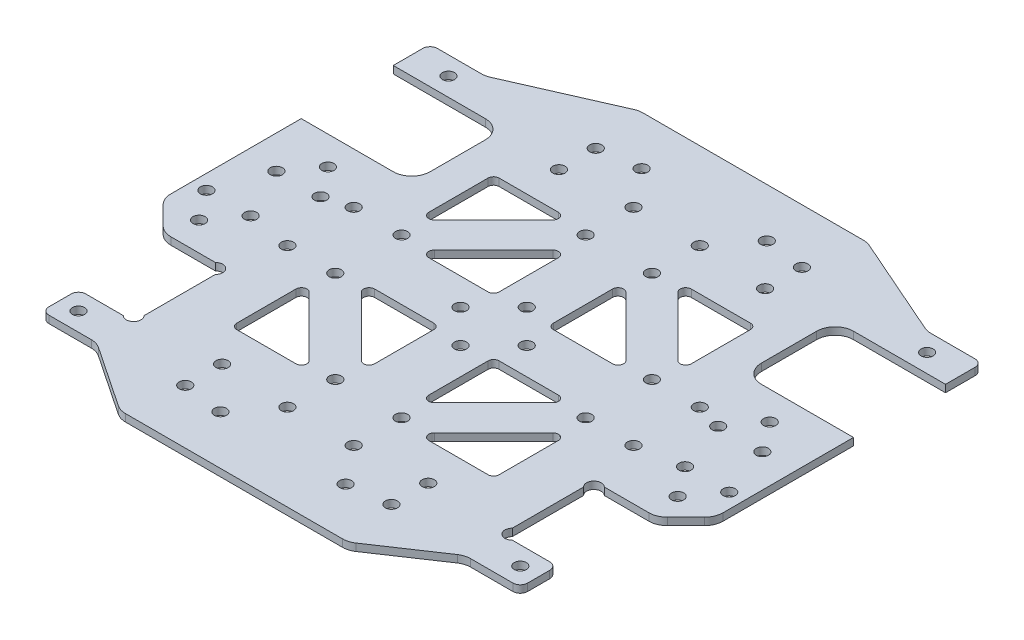
from build123d import *

# Parameters (mm, degrees)
SKETCH_1_W                         = 150
SKETCH_1_H                         = 141
EXTRUDE_1_DEPTH                    = 2
CUT_EXTRUDE_1_REACH                = 104.953
SKETCH_2_R                         = 1.65
CUT_EXTRUDE_5_REACH                = 104.953
SKETCH_9_W                         = 25
SKETCH_9_H                         = 47.75
CUT_EXTRUDE_6_REACH                = 104.953
CHAMFER_1_SIZE                     = 8
CUT_EXTRUDE_7_REACH                = 104.953
SKETCH_11_W                        = 30
SKETCH_11_H                        = 25
CUT_EXTRUDE_8_REACH                = 104.953
SKETCH_12_R                        = 1.65
FILLET_1_R                         = 5
CUT_EXTRUDE_9_REACH                = 104.953
SKETCH_14_W                        = 15
SKETCH_14_H                        = 10
EXTRUDE_2_DEPTH                    = 2
CUT_EXTRUDE_10_REACH               = 104.953
SKETCH_15_R                        = 1.65
CUT_EXTRUDE_START                  = -2
SKETCH_18_R                        = 2
CUT_EXTRUDE_13_DEPTH               = 2
CUT_EXTRUDE_14_REACH               = 104.953
SKETCH_19_R                        = 1.65
CUT_EXTRUDE_15_REACH               = 104.953
SKETCH_20_R                        = 1.65
FILLET_2_R                         = 2
CUT_EXTRUDE_12_REACH               = 104.953
SKETCH_17_R                        = 1.65
FILLET_3_R                         = 5
PATTERN_CIRCULAR_1_COUNT           = 2
PATTERN_CIRCULAR_1_ANGLE           = 90
PATTERN_CIRCULAR_1_COPY_1_REACH    = 104.953
PATTERN_CIRCULAR_1_COPY_1_SKETCH_R = 1.65
CUT_EXTRUDE_18_REACH               = 104.953
SKETCH_25_R                        = 1.65
CUT_EXTRUDE_19_REACH               = 104.953
FILLET_4_R                         = 1.5
FILLET_4_OF_MIRROR_6_R             = 1.5


with BuildPart() as part:
    # 草图1 → 凸台-拉伸1 (new body)
    with BuildSketch(Plane(origin=(0, 0, 0), x_dir=(1, 0, 0), z_dir=(0, 1, 0))):
        Rectangle(SKETCH_1_W, SKETCH_1_H)
    extrude(amount=EXTRUDE_1_DEPTH)

    # 草图2 → 切除-拉伸1 (cut, up to next)
    with BuildSketch(Plane(origin=(0, 2, 0), x_dir=(1, 0, 0), z_dir=(0, 1, 0)), mode=Mode.PRIVATE) as cut_extrude_1_sk1:
        with Locations(Location((-60, 15, 0), (0, 0, 270))):
            Circle(SKETCH_2_R)
    cut_extrude_1_tool1 = extrude(cut_extrude_1_sk1.sketch, amount=-CUT_EXTRUDE_1_REACH, mode=Mode.PRIVATE) & part.part
    # 草图2 → 切除-拉伸1 (cut, up to next)
    with BuildSketch(Plane(origin=(0, 2, 0), x_dir=(1, 0, 0), z_dir=(0, 1, 0)), mode=Mode.PRIVATE) as cut_extrude_1_sk2:
        with Locations(Location((-66, 7, 0), (0, 0, 270))):
            Circle(SKETCH_2_R)
    cut_extrude_1_tool2 = extrude(cut_extrude_1_sk2.sketch, amount=-CUT_EXTRUDE_1_REACH, mode=Mode.PRIVATE) & part.part
    # 草图2 → 切除-拉伸1 (cut, up to next)
    with BuildSketch(Plane(origin=(0, 2, 0), x_dir=(1, 0, 0), z_dir=(0, 1, 0)), mode=Mode.PRIVATE) as cut_extrude_1_sk3:
        with Locations(Location((-54, 7, 0), (0, 0, 270))):
            Circle(SKETCH_2_R)
    cut_extrude_1_tool3 = extrude(cut_extrude_1_sk3.sketch, amount=-CUT_EXTRUDE_1_REACH, mode=Mode.PRIVATE) & part.part
    # 草图2 → 切除-拉伸1 (cut, up to next)
    with BuildSketch(Plane(origin=(0, 2, 0), x_dir=(1, 0, 0), z_dir=(0, 1, 0)), mode=Mode.PRIVATE) as cut_extrude_1_sk4:
        with Locations(Location((-71, -7, 0), (0, 0, 270))):
            Circle(SKETCH_2_R)
    cut_extrude_1_tool4 = extrude(cut_extrude_1_sk4.sketch, amount=-CUT_EXTRUDE_1_REACH, mode=Mode.PRIVATE) & part.part
    # 草图2 → 切除-拉伸1 (cut, up to next)
    with BuildSketch(Plane(origin=(0, 2, 0), x_dir=(1, 0, 0), z_dir=(0, 1, 0)), mode=Mode.PRIVATE) as cut_extrude_1_sk5:
        with Locations(Location((-59, -7, 0), (0, 0, 270))):
            Circle(SKETCH_2_R)
    cut_extrude_1_tool5 = extrude(cut_extrude_1_sk5.sketch, amount=-CUT_EXTRUDE_1_REACH, mode=Mode.PRIVATE) & part.part
    # 草图2 → 切除-拉伸1 (cut, up to next)
    with BuildSketch(Plane(origin=(0, 2, 0), x_dir=(1, 0, 0), z_dir=(0, 1, 0)), mode=Mode.PRIVATE) as cut_extrude_1_sk6:
        with Locations(Location((-65, -15, 0), (0, 0, 270))):
            Circle(SKETCH_2_R)
    cut_extrude_1_tool6 = extrude(cut_extrude_1_sk6.sketch, amount=-CUT_EXTRUDE_1_REACH, mode=Mode.PRIVATE) & part.part
    cut_extrude_1_1 = cut_extrude_1_tool1.solids().sort_by_distance((-60, 2, -15))[0]
    add(cut_extrude_1_1, mode=Mode.SUBTRACT)
    cut_extrude_1_2 = cut_extrude_1_tool2.solids().sort_by_distance((-66, 2, -7))[0]
    add(cut_extrude_1_2, mode=Mode.SUBTRACT)
    cut_extrude_1_3 = cut_extrude_1_tool3.solids().sort_by_distance((-54, 2, -7))[0]
    add(cut_extrude_1_3, mode=Mode.SUBTRACT)
    cut_extrude_1_4 = cut_extrude_1_tool4.solids().sort_by_distance((-71, 2, 7))[0]
    add(cut_extrude_1_4, mode=Mode.SUBTRACT)
    cut_extrude_1_5 = cut_extrude_1_tool5.solids().sort_by_distance((-59, 2, 7))[0]
    add(cut_extrude_1_5, mode=Mode.SUBTRACT)
    cut_extrude_1_6 = cut_extrude_1_tool6.solids().sort_by_distance((-65, 2, 15))[0]
    add(cut_extrude_1_6, mode=Mode.SUBTRACT)
    cut_extrude_1 = cut_extrude_1_1 + cut_extrude_1_2 + cut_extrude_1_3 + cut_extrude_1_4 + cut_extrude_1_5 + cut_extrude_1_6  # 切除-拉伸1 as one shape, for the pattern or mirror that repeats it

    # 草图9 → 切除-拉伸5 (cut, up to next)
    with BuildSketch(Plane(origin=(0, 2, 0), x_dir=(1, 0, 0), z_dir=(0, 1, 0)), mode=Mode.PRIVATE) as cut_extrude_5_sk1:
        with Locations((-62.5, -46.625)):
            Rectangle(SKETCH_9_W, SKETCH_9_H)
    cut_extrude_5_tool1 = extrude(cut_extrude_5_sk1.sketch, amount=-CUT_EXTRUDE_5_REACH, mode=Mode.PRIVATE) & part.part
    # 草图9 → 切除-拉伸5 (cut, up to next)
    with BuildSketch(Plane(origin=(0, 2, 0), x_dir=(1, 0, 0), z_dir=(0, 1, 0)), mode=Mode.PRIVATE) as cut_extrude_5_sk2:
        with Locations((62.5, -46.625)):
            Rectangle(SKETCH_9_W, SKETCH_9_H)
    cut_extrude_5_tool2 = extrude(cut_extrude_5_sk2.sketch, amount=-CUT_EXTRUDE_5_REACH, mode=Mode.PRIVATE) & part.part
    add(cut_extrude_5_tool1.solids().sort_by_distance((-62.5, 2, 46.625))[0], mode=Mode.SUBTRACT)
    add(cut_extrude_5_tool2.solids().sort_by_distance((62.5, 2, 46.625))[0], mode=Mode.SUBTRACT)

    # 草图10 → 切除-拉伸6 (cut, up to next)
    with BuildSketch(Plane(origin=(0, 2, 0), x_dir=(1, 0, 0), z_dir=(0, 1, 0)), mode=Mode.PRIVATE) as cut_extrude_6_sk1:
        Polygon((-75, 70.5), (-31, 70.5), (-60, 57.75), (-75, 57.75), align=None)
    cut_extrude_6_tool1 = extrude(cut_extrude_6_sk1.sketch, amount=-CUT_EXTRUDE_6_REACH, mode=Mode.PRIVATE) & part.part
    cut_extrude_6 = cut_extrude_6_tool1.solids().sort_by_distance((-59.062147, 2, -65.169492))[0]
    add(cut_extrude_6, mode=Mode.SUBTRACT)

    # 镜向1: 切除-拉伸1, 切除-拉伸6 across plane
    add(cut_extrude_1.mirror(Plane(origin=(0, 0, 0), x_dir=(0, 0, 1), z_dir=(1, 0, 0))), mode=Mode.SUBTRACT)
    add(cut_extrude_6.mirror(Plane(origin=(0, 0, 0), x_dir=(0, 0, 1), z_dir=(1, 0, 0))), mode=Mode.SUBTRACT)

    # 倒角1
    chamfer_1_edges = [part.edges().sort_by_distance(p)[0] for p in [
        (-75, 1, 22.75),
        (75, 1, 22.75),
    ]]
    chamfer(chamfer_1_edges, length=CHAMFER_1_SIZE)

    # 草图11 → 切除-拉伸7 (cut, up to next)
    with BuildSketch(Plane(origin=(0, 2, 0), x_dir=(1, 0, 0), z_dir=(0, 1, 0)), mode=Mode.PRIVATE) as cut_extrude_7_sk1:
        with Locations((-60, 35.25)):
            Rectangle(SKETCH_11_W, SKETCH_11_H)
    cut_extrude_7_tool1 = extrude(cut_extrude_7_sk1.sketch, amount=-CUT_EXTRUDE_7_REACH, mode=Mode.PRIVATE) & part.part
    # 草图11 → 切除-拉伸7 (cut, up to next)
    with BuildSketch(Plane(origin=(0, 2, 0), x_dir=(1, 0, 0), z_dir=(0, 1, 0)), mode=Mode.PRIVATE) as cut_extrude_7_sk2:
        with Locations((60, 35.25)):
            Rectangle(SKETCH_11_W, SKETCH_11_H)
    cut_extrude_7_tool2 = extrude(cut_extrude_7_sk2.sketch, amount=-CUT_EXTRUDE_7_REACH, mode=Mode.PRIVATE) & part.part
    add(cut_extrude_7_tool1.solids().sort_by_distance((-60, 2, -35.25))[0], mode=Mode.SUBTRACT)
    add(cut_extrude_7_tool2.solids().sort_by_distance((60, 2, -35.25))[0], mode=Mode.SUBTRACT)

    # 草图12 → 切除-拉伸8 (cut, up to next)
    with BuildSketch(Plane(origin=(0, 2, 0), x_dir=(1, 0, 0), z_dir=(0, 1, 0)), mode=Mode.PRIVATE) as cut_extrude_8_sk1:
        with Locations(Location((-65, 52.75, 0), (0, 0, 270))):
            Circle(SKETCH_12_R)
    cut_extrude_8_tool1 = extrude(cut_extrude_8_sk1.sketch, amount=-CUT_EXTRUDE_8_REACH, mode=Mode.PRIVATE) & part.part
    # 草图12 → 切除-拉伸8 (cut, up to next)
    with BuildSketch(Plane(origin=(0, 2, 0), x_dir=(1, 0, 0), z_dir=(0, 1, 0)), mode=Mode.PRIVATE) as cut_extrude_8_sk2:
        with Locations(Location((65, 52.75, 0), (0, 0, 90))):
            Circle(SKETCH_12_R)
    cut_extrude_8_tool2 = extrude(cut_extrude_8_sk2.sketch, amount=-CUT_EXTRUDE_8_REACH, mode=Mode.PRIVATE) & part.part
    add(cut_extrude_8_tool1.solids().sort_by_distance((-65, 2, -52.75))[0], mode=Mode.SUBTRACT)
    add(cut_extrude_8_tool2.solids().sort_by_distance((65, 2, -52.75))[0], mode=Mode.SUBTRACT)

    # 圆角1
    fillet_1_edges = [part.edges().sort_by_distance(p)[0] for p in [
        (67, 1, 22.75),
        (75, 1, 14.75),
        (-75, 1, 14.75),
        (-67, 1, 22.75),
        (-45, 1, -47.75),
        (-45, 1, -22.75),
        (45, 1, -22.75),
        (45, 1, -47.75),
    ]]
    fillet(fillet_1_edges, radius=FILLET_1_R)

    # 草图13 → 切除-拉伸9 (cut, up to next)
    with BuildSketch(Plane(origin=(0, 2, 0), x_dir=(1, 0, 0), z_dir=(0, 1, 0)), mode=Mode.PRIVATE) as cut_extrude_9_sk1:
        Polygon((-50, -70.5), (-50, -57.75), (-31, -70.5), align=None)
    cut_extrude_9_tool1 = extrude(cut_extrude_9_sk1.sketch, amount=-CUT_EXTRUDE_9_REACH, mode=Mode.PRIVATE) & part.part
    cut_extrude_9 = cut_extrude_9_tool1.solids().sort_by_distance((-43.666667, 2, 66.25))[0]
    add(cut_extrude_9, mode=Mode.SUBTRACT)

    # 草图14 → 凸台-拉伸2 (add)
    with BuildSketch(Plane(origin=(0, 0, 0), x_dir=(1, 0, 0), z_dir=(0, 1, 0))):
        with Locations((-57.5, -52.75)):
            Rectangle(SKETCH_14_W, SKETCH_14_H)
    extrude_2 = extrude(amount=EXTRUDE_2_DEPTH)

    # 草图15 → 切除-拉伸10 (cut, up to next)
    with BuildSketch(Plane(origin=(0, 2, 0), x_dir=(1, 0, 0), z_dir=(0, 1, 0)), mode=Mode.PRIVATE) as cut_extrude_10_sk1:
        with Locations(Location((-60, -52.75, 0), (0, 0, 270))):
            Circle(SKETCH_15_R)
    cut_extrude_10_tool1 = extrude(cut_extrude_10_sk1.sketch, amount=-CUT_EXTRUDE_10_REACH, mode=Mode.PRIVATE) & part.part
    cut_extrude_10 = cut_extrude_10_tool1.solids().sort_by_distance((-60, 2, 52.75))[0]
    add(cut_extrude_10, mode=Mode.SUBTRACT)

    # 草图18 → 切除-拉伸13 (cut)
    with BuildSketch(Plane(origin=(0, 2, 0), x_dir=(1, 0, 0), z_dir=(0, 1, 0)).offset(CUT_EXTRUDE_START)):
        with Locations((-51.414213562, -24.164213562)):
            Circle(SKETCH_18_R)
        with Locations((-51.414213562, -46.335786438)):
            Circle(SKETCH_18_R)
    cut_extrude_13 = extrude(amount=CUT_EXTRUDE_13_DEPTH, mode=Mode.SUBTRACT)

    # 草图19 → 切除-拉伸14 (cut, up to next)
    with BuildSketch(Plane(origin=(0, 2, 0), x_dir=(1, 0, 0), z_dir=(0, 1, 0)), mode=Mode.PRIVATE) as cut_extrude_14_sk1:
        with Locations(Location((-47, 9, 0), (0, 0, 270))):
            Circle(SKETCH_19_R)
    cut_extrude_14_tool1 = extrude(cut_extrude_14_sk1.sketch, amount=-CUT_EXTRUDE_14_REACH, mode=Mode.PRIVATE) & part.part
    # 草图19 → 切除-拉伸14 (cut, up to next)
    with BuildSketch(Plane(origin=(0, 2, 0), x_dir=(1, 0, 0), z_dir=(0, 1, 0)), mode=Mode.PRIVATE) as cut_extrude_14_sk2:
        with Locations(Location((-47, -9, 0), (0, 0, 270))):
            Circle(SKETCH_19_R)
    cut_extrude_14_tool2 = extrude(cut_extrude_14_sk2.sketch, amount=-CUT_EXTRUDE_14_REACH, mode=Mode.PRIVATE) & part.part
    # 草图19 → 切除-拉伸14 (cut, up to next)
    with BuildSketch(Plane(origin=(0, 2, 0), x_dir=(1, 0, 0), z_dir=(0, 1, 0)), mode=Mode.PRIVATE) as cut_extrude_14_sk3:
        with Locations(Location((-34, -9, 0), (0, 0, 270))):
            Circle(SKETCH_19_R)
    cut_extrude_14_tool3 = extrude(cut_extrude_14_sk3.sketch, amount=-CUT_EXTRUDE_14_REACH, mode=Mode.PRIVATE) & part.part
    # 草图19 → 切除-拉伸14 (cut, up to next)
    with BuildSketch(Plane(origin=(0, 2, 0), x_dir=(1, 0, 0), z_dir=(0, 1, 0)), mode=Mode.PRIVATE) as cut_extrude_14_sk4:
        with Locations(Location((-34, 9, 0), (0, 0, 270))):
            Circle(SKETCH_19_R)
    cut_extrude_14_tool4 = extrude(cut_extrude_14_sk4.sketch, amount=-CUT_EXTRUDE_14_REACH, mode=Mode.PRIVATE) & part.part
    cut_extrude_14_1 = cut_extrude_14_tool1.solids().sort_by_distance((-47, 2, -9))[0]
    add(cut_extrude_14_1, mode=Mode.SUBTRACT)
    cut_extrude_14_2 = cut_extrude_14_tool2.solids().sort_by_distance((-47, 2, 9))[0]
    add(cut_extrude_14_2, mode=Mode.SUBTRACT)
    cut_extrude_14_3 = cut_extrude_14_tool3.solids().sort_by_distance((-34, 2, 9))[0]
    add(cut_extrude_14_3, mode=Mode.SUBTRACT)
    cut_extrude_14_4 = cut_extrude_14_tool4.solids().sort_by_distance((-34, 2, -9))[0]
    add(cut_extrude_14_4, mode=Mode.SUBTRACT)
    cut_extrude_14 = cut_extrude_14_1 + cut_extrude_14_2 + cut_extrude_14_3 + cut_extrude_14_4  # 切除-拉伸14 as one shape, for the pattern or mirror that repeats it

    # 镜向2: 切除-拉伸9, 凸台-拉伸2, 切除-拉伸10, 切除-拉伸13 across plane
    add(cut_extrude_9.mirror(Plane(origin=(0, 0, 0), x_dir=(0, 0, 1), z_dir=(1, 0, 0))), mode=Mode.SUBTRACT)
    add(extrude_2.mirror(Plane(origin=(0, 0, 0), x_dir=(0, 0, 1), z_dir=(1, 0, 0))))
    add(cut_extrude_10.mirror(Plane(origin=(0, 0, 0), x_dir=(0, 0, 1), z_dir=(1, 0, 0))), mode=Mode.SUBTRACT)
    add(cut_extrude_13.mirror(Plane(origin=(0, 0, 0), x_dir=(0, 0, 1), z_dir=(1, 0, 0))), mode=Mode.SUBTRACT)

    # 镜向4: 切除-拉伸14 across plane
    add(cut_extrude_14.mirror(Plane(origin=(0, 0, 0), x_dir=(0, 0, 1), z_dir=(1, 0, 0))), mode=Mode.SUBTRACT)

    # 草图20 → 切除-拉伸15 (cut, up to next)
    with BuildSketch(Plane(origin=(0, 2, 0), x_dir=(1, 0, 0), z_dir=(0, 1, 0)), mode=Mode.PRIVATE) as cut_extrude_15_sk1:
        with Locations(Location((0, 9, 0), (0, 0, 270))):
            Circle(SKETCH_20_R)
    cut_extrude_15_tool1 = extrude(cut_extrude_15_sk1.sketch, amount=-CUT_EXTRUDE_15_REACH, mode=Mode.PRIVATE) & part.part
    # 草图20 → 切除-拉伸15 (cut, up to next)
    with BuildSketch(Plane(origin=(0, 2, 0), x_dir=(1, 0, 0), z_dir=(0, 1, 0)), mode=Mode.PRIVATE) as cut_extrude_15_sk2:
        with Locations(Location((0, -9, 0), (0, 0, 270))):
            Circle(SKETCH_20_R)
    cut_extrude_15_tool2 = extrude(cut_extrude_15_sk2.sketch, amount=-CUT_EXTRUDE_15_REACH, mode=Mode.PRIVATE) & part.part
    cut_extrude_15_1 = cut_extrude_15_tool1.solids().sort_by_distance((0, 2, -9))[0]
    add(cut_extrude_15_1, mode=Mode.SUBTRACT)
    cut_extrude_15_2 = cut_extrude_15_tool2.solids().sort_by_distance((0, 2, 9))[0]
    add(cut_extrude_15_2, mode=Mode.SUBTRACT)
    cut_extrude_15 = cut_extrude_15_1 + cut_extrude_15_2  # 切除-拉伸15 as one shape, for the pattern or mirror that repeats it

    # 圆角2
    fillet_2_edges = [part.edges().sort_by_distance(p)[0] for p in [
        (75, 1, -57.75),
        (-65, 1, 57.75),
        (-65, 1, 47.75),
        (65, 1, 57.75),
        (65, 1, 47.75),
        (-75, 1, -57.75),
    ]]
    fillet(fillet_2_edges, radius=FILLET_2_R)

    # 草图17 → 切除-拉伸12 (cut, up to next)
    with BuildSketch(Plane(origin=(0, 2, 0), x_dir=(1, 0, 0), z_dir=(0, 1, 0)), mode=Mode.PRIVATE) as cut_extrude_12_sk1:
        with Locations(Location((-28, -45.75, 0), (0, 0, 270))):
            Circle(SKETCH_17_R)
    cut_extrude_12_tool1 = extrude(cut_extrude_12_sk1.sketch, amount=-CUT_EXTRUDE_12_REACH, mode=Mode.PRIVATE) & part.part
    # 草图17 → 切除-拉伸12 (cut, up to next)
    with BuildSketch(Plane(origin=(0, 2, 0), x_dir=(1, 0, 0), z_dir=(0, 1, 0)), mode=Mode.PRIVATE) as cut_extrude_12_sk2:
        with Locations(Location((-28, -55.75, 0), (0, 0, 270))):
            Circle(SKETCH_17_R)
    cut_extrude_12_tool2 = extrude(cut_extrude_12_sk2.sketch, amount=-CUT_EXTRUDE_12_REACH, mode=Mode.PRIVATE) & part.part
    # 草图17 → 切除-拉伸12 (cut, up to next)
    with BuildSketch(Plane(origin=(0, 2, 0), x_dir=(1, 0, 0), z_dir=(0, 1, 0)), mode=Mode.PRIVATE) as cut_extrude_12_sk3:
        with Locations(Location((28, -45.75, 0), (0, 0, 270))):
            Circle(SKETCH_17_R)
    cut_extrude_12_tool3 = extrude(cut_extrude_12_sk3.sketch, amount=-CUT_EXTRUDE_12_REACH, mode=Mode.PRIVATE) & part.part
    # 草图17 → 切除-拉伸12 (cut, up to next)
    with BuildSketch(Plane(origin=(0, 2, 0), x_dir=(1, 0, 0), z_dir=(0, 1, 0)), mode=Mode.PRIVATE) as cut_extrude_12_sk4:
        with Locations(Location((28, -55.75, 0), (0, 0, 270))):
            Circle(SKETCH_17_R)
    cut_extrude_12_tool4 = extrude(cut_extrude_12_sk4.sketch, amount=-CUT_EXTRUDE_12_REACH, mode=Mode.PRIVATE) & part.part
    cut_extrude_12_1 = cut_extrude_12_tool1.solids().sort_by_distance((-28, 2, 45.75))[0]
    add(cut_extrude_12_1, mode=Mode.SUBTRACT)
    cut_extrude_12_2 = cut_extrude_12_tool2.solids().sort_by_distance((-28, 2, 55.75))[0]
    add(cut_extrude_12_2, mode=Mode.SUBTRACT)
    cut_extrude_12_3 = cut_extrude_12_tool3.solids().sort_by_distance((28, 2, 45.75))[0]
    add(cut_extrude_12_3, mode=Mode.SUBTRACT)
    cut_extrude_12_4 = cut_extrude_12_tool4.solids().sort_by_distance((28, 2, 55.75))[0]
    add(cut_extrude_12_4, mode=Mode.SUBTRACT)
    cut_extrude_12 = cut_extrude_12_1 + cut_extrude_12_2 + cut_extrude_12_3 + cut_extrude_12_4  # 切除-拉伸12 as one shape, for the pattern or mirror that repeats it

    # 镜向3: 切除-拉伸12 across plane
    add(cut_extrude_12.mirror(Plane.XY), mode=Mode.SUBTRACT)

    # 圆角3
    fillet_3_edges = [part.edges().sort_by_distance(p)[0] for p in [
        (60, 1, -57.75),
        (31, 1, -70.5),
        (-31, 1, 70.5),
        (-50, 1, 57.75),
        (31, 1, 70.5),
        (50, 1, 57.75),
        (-31, 1, -70.5),
        (-60, 1, -57.75),
    ]]
    fillet(fillet_3_edges, radius=FILLET_3_R)

    # 阵列(圆周)1: 切除-拉伸14, 切除-拉伸15 ×2 about axis
    pattern_circular_1_axis = Axis((0, 0, 0), (0, -1, 0))
    add([cut_extrude_14.rotate(pattern_circular_1_axis, i * PATTERN_CIRCULAR_1_ANGLE / (PATTERN_CIRCULAR_1_COUNT - 1)) for i in range(1, PATTERN_CIRCULAR_1_COUNT)], mode=Mode.SUBTRACT)
    add([cut_extrude_15.rotate(pattern_circular_1_axis, i * PATTERN_CIRCULAR_1_ANGLE / (PATTERN_CIRCULAR_1_COUNT - 1)) for i in range(1, PATTERN_CIRCULAR_1_COUNT)], mode=Mode.SUBTRACT)

    # 阵列(圆周)1 copy 1 sketch → 阵列(圆周)1 copy 1 (cut, up to next)
    with BuildSketch(Plane(origin=(0, 2, 0), x_dir=(0, 0, -1), z_dir=(0, 1, 0)), mode=Mode.PRIVATE) as pattern_circular_1_copy_1_sk1:
        with Locations((-47, -9)):
            Circle(PATTERN_CIRCULAR_1_COPY_1_SKETCH_R)
    pattern_circular_1_copy_1_tool1 = extrude(pattern_circular_1_copy_1_sk1.sketch, amount=-PATTERN_CIRCULAR_1_COPY_1_REACH, mode=Mode.PRIVATE) & part.part
    # 阵列(圆周)1 copy 1 sketch → 阵列(圆周)1 copy 1 (cut, up to next)
    with BuildSketch(Plane(origin=(0, 2, 0), x_dir=(0, 0, -1), z_dir=(0, 1, 0)), mode=Mode.PRIVATE) as pattern_circular_1_copy_1_sk2:
        with Locations((-47, 9)):
            Circle(PATTERN_CIRCULAR_1_COPY_1_SKETCH_R)
    pattern_circular_1_copy_1_tool2 = extrude(pattern_circular_1_copy_1_sk2.sketch, amount=-PATTERN_CIRCULAR_1_COPY_1_REACH, mode=Mode.PRIVATE) & part.part
    # 阵列(圆周)1 copy 1 sketch → 阵列(圆周)1 copy 1 (cut, up to next)
    with BuildSketch(Plane(origin=(0, 2, 0), x_dir=(0, 0, -1), z_dir=(0, 1, 0)), mode=Mode.PRIVATE) as pattern_circular_1_copy_1_sk3:
        with Locations((-34, 9)):
            Circle(PATTERN_CIRCULAR_1_COPY_1_SKETCH_R)
    pattern_circular_1_copy_1_tool3 = extrude(pattern_circular_1_copy_1_sk3.sketch, amount=-PATTERN_CIRCULAR_1_COPY_1_REACH, mode=Mode.PRIVATE) & part.part
    # 阵列(圆周)1 copy 1 sketch → 阵列(圆周)1 copy 1 (cut, up to next)
    with BuildSketch(Plane(origin=(0, 2, 0), x_dir=(0, 0, -1), z_dir=(0, 1, 0)), mode=Mode.PRIVATE) as pattern_circular_1_copy_1_sk4:
        with Locations((-34, -9)):
            Circle(PATTERN_CIRCULAR_1_COPY_1_SKETCH_R)
    pattern_circular_1_copy_1_tool4 = extrude(pattern_circular_1_copy_1_sk4.sketch, amount=-PATTERN_CIRCULAR_1_COPY_1_REACH, mode=Mode.PRIVATE) & part.part
    add(pattern_circular_1_copy_1_tool1.solids().sort_by_distance((9, 2, 47))[0], mode=Mode.SUBTRACT)
    add(pattern_circular_1_copy_1_tool2.solids().sort_by_distance((-9, 2, 47))[0], mode=Mode.SUBTRACT)
    add(pattern_circular_1_copy_1_tool3.solids().sort_by_distance((-9, 2, 34))[0], mode=Mode.SUBTRACT)
    add(pattern_circular_1_copy_1_tool4.solids().sort_by_distance((9, 2, 34))[0], mode=Mode.SUBTRACT)

    # 草图25 → 切除-拉伸18 (cut, up to next)
    with BuildSketch(Plane(origin=(0, 2, 0), x_dir=(1, 0, 0), z_dir=(0, 1, 0)), mode=Mode.PRIVATE) as cut_extrude_18_sk1:
        with Locations(Location((17, 57.2, 0), (0, 0, 270))):
            Circle(SKETCH_25_R)
    cut_extrude_18_tool1 = extrude(cut_extrude_18_sk1.sketch, amount=-CUT_EXTRUDE_18_REACH, mode=Mode.PRIVATE) & part.part
    # 草图25 → 切除-拉伸18 (cut, up to next)
    with BuildSketch(Plane(origin=(0, 2, 0), x_dir=(1, 0, 0), z_dir=(0, 1, 0)), mode=Mode.PRIVATE) as cut_extrude_18_sk2:
        with Locations(Location((-17, 57.2, 0), (0, 0, 270))):
            Circle(SKETCH_25_R)
    cut_extrude_18_tool2 = extrude(cut_extrude_18_sk2.sketch, amount=-CUT_EXTRUDE_18_REACH, mode=Mode.PRIVATE) & part.part
    # 草图25 → 切除-拉伸18 (cut, up to next)
    with BuildSketch(Plane(origin=(0, 2, 0), x_dir=(1, 0, 0), z_dir=(0, 1, 0)), mode=Mode.PRIVATE) as cut_extrude_18_sk3:
        with Locations(Location((-17, -57.2, 0), (0, 0, 270))):
            Circle(SKETCH_25_R)
    cut_extrude_18_tool3 = extrude(cut_extrude_18_sk3.sketch, amount=-CUT_EXTRUDE_18_REACH, mode=Mode.PRIVATE) & part.part
    # 草图25 → 切除-拉伸18 (cut, up to next)
    with BuildSketch(Plane(origin=(0, 2, 0), x_dir=(1, 0, 0), z_dir=(0, 1, 0)), mode=Mode.PRIVATE) as cut_extrude_18_sk4:
        with Locations(Location((17, -57.2, 0), (0, 0, 270))):
            Circle(SKETCH_25_R)
    cut_extrude_18_tool4 = extrude(cut_extrude_18_sk4.sketch, amount=-CUT_EXTRUDE_18_REACH, mode=Mode.PRIVATE) & part.part
    add(cut_extrude_18_tool1.solids().sort_by_distance((17, 2, -57.2))[0], mode=Mode.SUBTRACT)
    add(cut_extrude_18_tool2.solids().sort_by_distance((-17, 2, -57.2))[0], mode=Mode.SUBTRACT)
    add(cut_extrude_18_tool3.solids().sort_by_distance((-17, 2, 57.2))[0], mode=Mode.SUBTRACT)
    add(cut_extrude_18_tool4.solids().sort_by_distance((17, 2, 57.2))[0], mode=Mode.SUBTRACT)

    # 草图26 → 切除-拉伸19 (cut, up to next)
    with BuildSketch(Plane(origin=(0, 2, 0), x_dir=(1, 0, 0), z_dir=(0, 1, 0)), mode=Mode.PRIVATE) as cut_extrude_19_sk1:
        Polygon((-28.571067812, -7.357864376), (-7.357864376, -28.571067812), (-7.357864376, -7.357864376), align=None)
    cut_extrude_19_tool1 = extrude(cut_extrude_19_sk1.sketch, amount=-CUT_EXTRUDE_19_REACH, mode=Mode.PRIVATE) & part.part
    # 草图26 → 切除-拉伸19 (cut, up to next)
    with BuildSketch(Plane(origin=(0, 2, 0), x_dir=(1, 0, 0), z_dir=(0, 1, 0)), mode=Mode.PRIVATE) as cut_extrude_19_sk2:
        Polygon((-35.642135624, -14.428932188), (-14.428932188, -35.642135624), (-35.642135624, -35.642135624), align=None)
    cut_extrude_19_tool2 = extrude(cut_extrude_19_sk2.sketch, amount=-CUT_EXTRUDE_19_REACH, mode=Mode.PRIVATE) & part.part
    # 草图26 → 切除-拉伸19 (cut, up to next)
    with BuildSketch(Plane(origin=(0, 2, 0), x_dir=(1, 0, 0), z_dir=(0, 1, 0)), mode=Mode.PRIVATE) as cut_extrude_19_sk3:
        Polygon((14.428932188, 35.642135624), (35.642135624, 14.428932188), (35.642135624, 35.642135624), align=None)
    cut_extrude_19_tool3 = extrude(cut_extrude_19_sk3.sketch, amount=-CUT_EXTRUDE_19_REACH, mode=Mode.PRIVATE) & part.part
    # 草图26 → 切除-拉伸19 (cut, up to next)
    with BuildSketch(Plane(origin=(0, 2, 0), x_dir=(1, 0, 0), z_dir=(0, 1, 0)), mode=Mode.PRIVATE) as cut_extrude_19_sk4:
        Polygon((7.357864376, 28.571067812), (28.571067812, 7.357864376), (7.357864376, 7.357864376), align=None)
    cut_extrude_19_tool4 = extrude(cut_extrude_19_sk4.sketch, amount=-CUT_EXTRUDE_19_REACH, mode=Mode.PRIVATE) & part.part
    cut_extrude_19_1 = cut_extrude_19_tool1.solids().sort_by_distance((-14.428932, 2, 14.428932))[0]
    add(cut_extrude_19_1, mode=Mode.SUBTRACT)
    cut_extrude_19_2 = cut_extrude_19_tool2.solids().sort_by_distance((-28.571068, 2, 28.571068))[0]
    add(cut_extrude_19_2, mode=Mode.SUBTRACT)
    cut_extrude_19_3 = cut_extrude_19_tool3.solids().sort_by_distance((28.571068, 2, -28.571068))[0]
    add(cut_extrude_19_3, mode=Mode.SUBTRACT)
    cut_extrude_19_4 = cut_extrude_19_tool4.solids().sort_by_distance((14.428932, 2, -14.428932))[0]
    add(cut_extrude_19_4, mode=Mode.SUBTRACT)
    cut_extrude_19 = cut_extrude_19_1 + cut_extrude_19_2 + cut_extrude_19_3 + cut_extrude_19_4  # 切除-拉伸19 as one shape, for the pattern or mirror that repeats it

    # 圆角4
    fillet_4_edges = [part.edges().sort_by_distance(p)[0] for p in [
        (-28.571067812, 1, 7.357864376),
        (-7.357864376, 1, 7.357864376),
        (-7.357864376, 1, 28.571067812),
        (28.571067812, 1, -7.357864376),
        (7.357864376, 1, -7.357864376),
        (7.357864376, 1, -28.571067812),
        (14.428932188, 1, -35.642135624),
        (35.642135624, 1, -35.642135624),
        (35.642135624, 1, -14.428932188),
        (-14.428932188, 1, 35.642135624),
        (-35.642135624, 1, 35.642135624),
        (-35.642135624, 1, 14.428932188),
    ]]
    fillet(fillet_4_edges, radius=FILLET_4_R)

    # 镜向6: 切除-拉伸19 across plane
    add(cut_extrude_19.mirror(Plane(origin=(0, 0, 0), x_dir=(0, 0, 1), z_dir=(1, 0, 0))), mode=Mode.SUBTRACT)

    # 圆角4 of 镜向6
    fillet_4_of_mirror_6_edges = [part.edges().sort_by_distance(p)[0] for p in [
        (28.571067812, 1, 7.357864376),
        (7.357864376, 1, 7.357864376),
        (7.357864376, 1, 28.571067812),
        (-28.571067812, 1, -7.357864376),
        (-7.357864376, 1, -7.357864376),
        (-7.357864376, 1, -28.571067812),
        (-14.428932188, 1, -35.642135624),
        (-35.642135624, 1, -35.642135624),
        (-35.642135624, 1, -14.428932188),
        (14.428932188, 1, 35.642135624),
        (35.642135624, 1, 35.642135624),
        (35.642135624, 1, 14.428932188),
    ]]
    fillet(fillet_4_of_mirror_6_edges, radius=FILLET_4_OF_MIRROR_6_R)


solid = part.part
